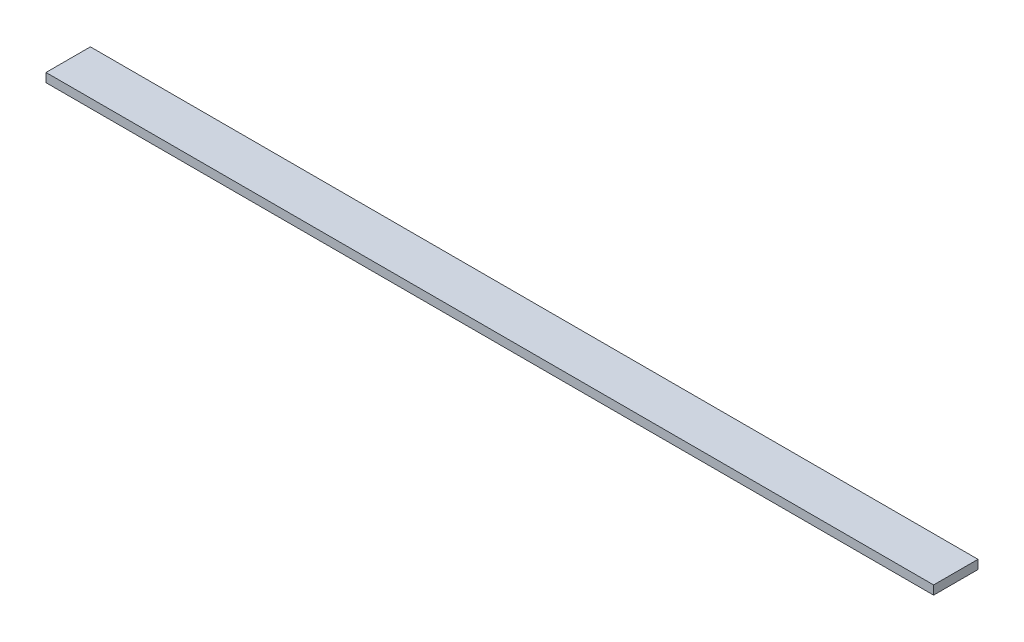
from build123d import *

# Parameters (mm, degrees)
PACK_SARJOR_ALT_TUTUCU_RAY_1_1_START = -780
SKETCH1_W                            = 400
SKETCH1_H                            = 4
PACK_SARJOR_ALT_TUTUCU_RAY_1_1_DEPTH = 20


with BuildPart() as part:
    # Sketch1 → PACK_sarjor_alt_tutucu_ray_1_1 (new body)
    with BuildSketch(Plane.XY.offset(PACK_SARJOR_ALT_TUTUCU_RAY_1_1_START)):
        with Locations((350, 1042)):
            Rectangle(SKETCH1_W, SKETCH1_H)
    extrude(amount=-PACK_SARJOR_ALT_TUTUCU_RAY_1_1_DEPTH)


solid = part.part
